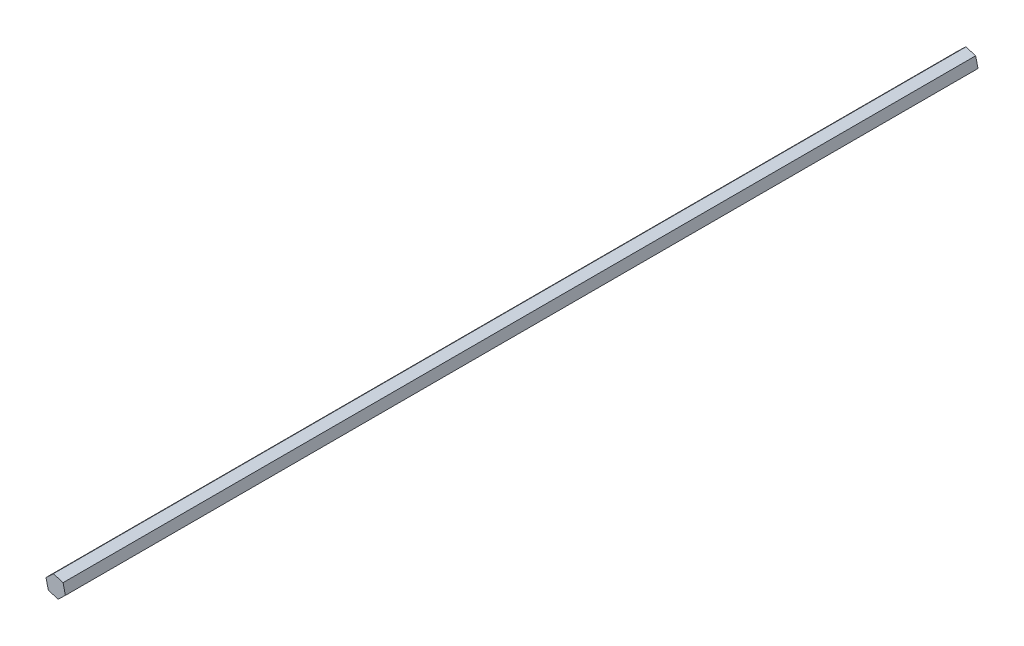
from build123d import *

# Parameters (mm, degrees)
BOSS_EXTRUDE1_DEPTH = 660.4


with BuildPart() as part:
    # Sketch1 → Boss-Extrude1 (new body)
    with BuildSketch(Plane.XY):
        Polygon((7.026499747, -2.095622732), (5.328112396, 5.037315915), (-1.698387351, 7.132938647), (-7.026499747, 2.095622732), (-5.328112396, -5.037315915), (1.698387351, -7.132938647), align=None)
    extrude(amount=BOSS_EXTRUDE1_DEPTH)


solid = part.part
